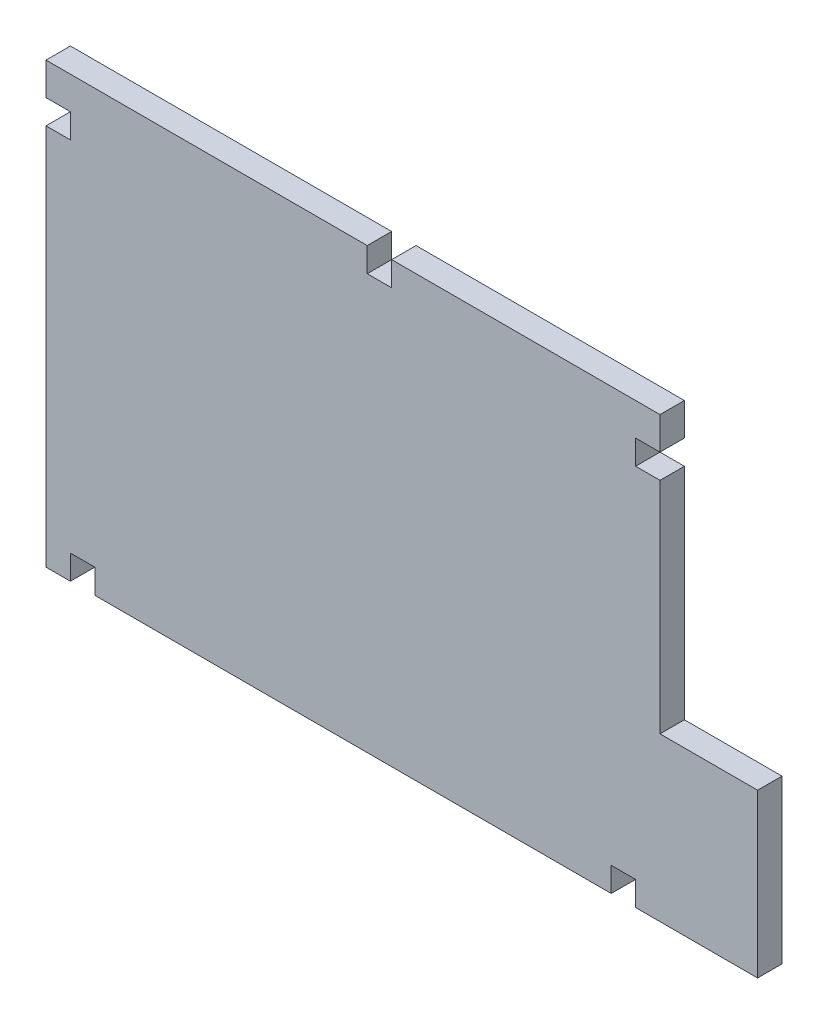
from build123d import *

# Parameters (mm, degrees)
EXTRUDE_1_DEPTH = 3


with BuildPart() as part:
    # 草图1 → 凸台-拉伸1 (new body)
    with BuildSketch(Plane.XY):
        Polygon((0, 0), (0, -4), (3, -4), (3, -7), (0, -7), (0, -54), (3, -54), (3, -51), (6, -51), (6, -54), (69.5, -54), (69.5, -51), (72.5, -51), (72.5, -54), (87.5, -54), (87.5, -34), (75.5, -34), (75.5, -7), (72.5, -7), (72.5, -4), (75.5, -4), (75.5, 0), (42.5, 0), (42.5, -3), (39.5, -3), (39.5, 0), align=None)
    extrude(amount=EXTRUDE_1_DEPTH)


solid = part.part
